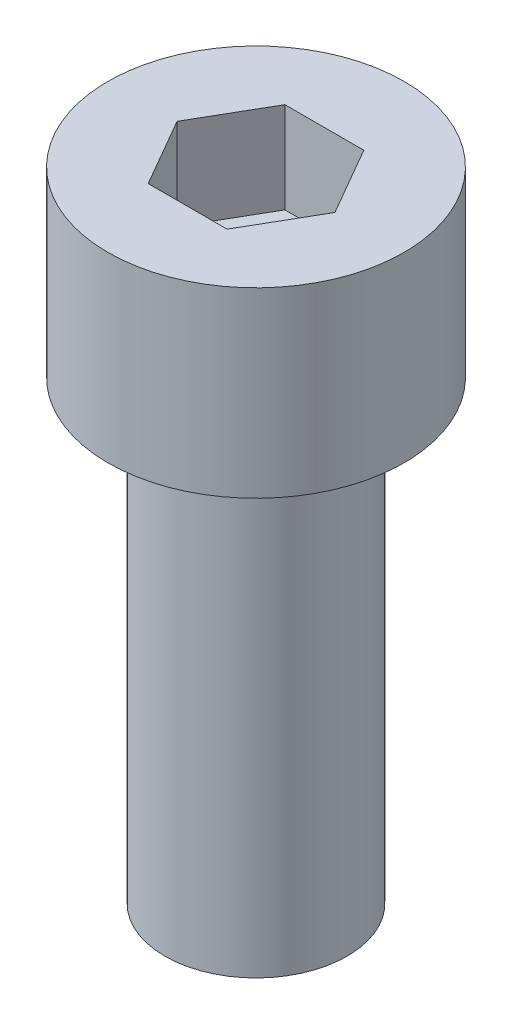
from build123d import *

# Parameters (mm, degrees)
CUT_EXTRUDE1_DEPTH = 4


with BuildPart() as part:
    # Sketch1 → Revolve1 (revolve)
    with BuildSketch(Plane.XY, mode=Mode.PRIVATE) as revolve1_sk:
        Polygon((0, -20), (4, -20), (4, 0), (6.5, 0), (6.5, 8), (0, 8), align=None)
    revolve(revolve1_sk.sketch.rotate(Axis((0, 61.691642626, 0), (0, -1, 0)), 90), axis=Axis((0, 61.691642626, 0), (0, -1, 0)))

    # Sketch2 → Cut-Extrude1 (cut)
    with BuildSketch(Plane(origin=(0, 8, 0), x_dir=(-1, 0, 0), z_dir=(0, 1, 0))):
        Polygon((-1.732050808, -3), (1.732050808, -3), (3.464101615, 0), (1.732050808, 3), (-1.732050808, 3), (-3.464101615, 0), align=None)
    extrude(amount=-CUT_EXTRUDE1_DEPTH, mode=Mode.SUBTRACT)


solid = part.part
